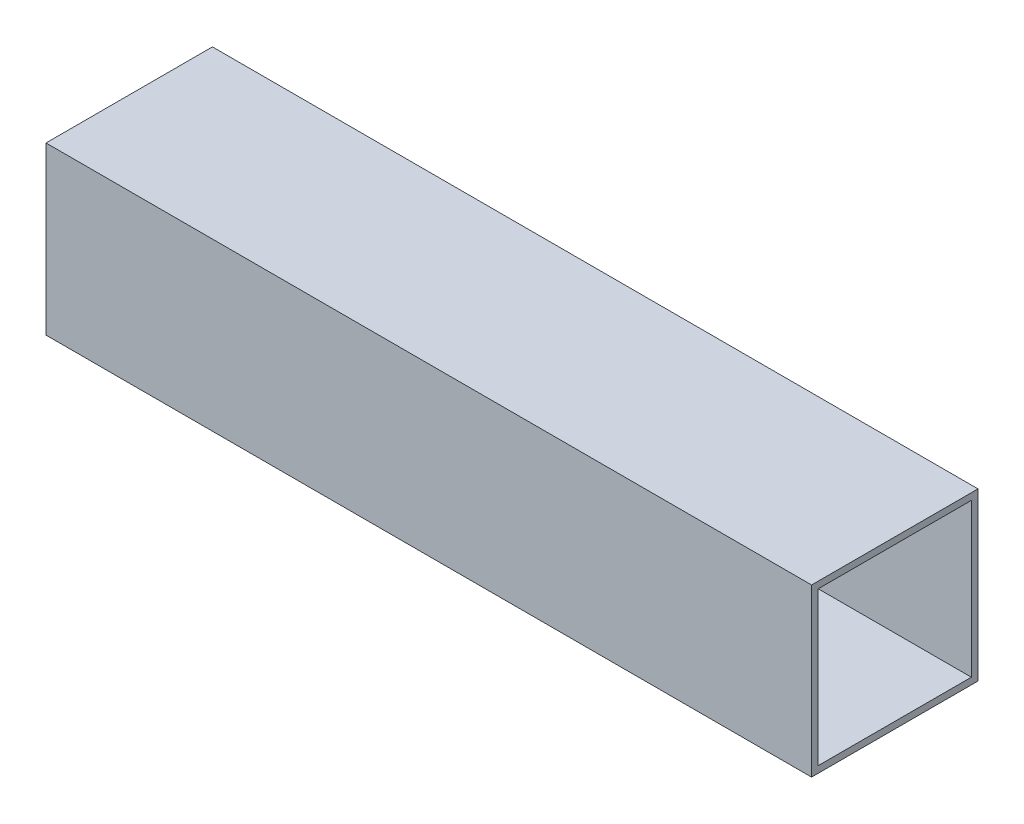
from build123d import *

# Parameters (mm, degrees)
SKETCH1_W           = 25
SKETCH1_H           = 25
SKETCH1_W_2         = 23
SKETCH1_H_2         = 23
BOSS_EXTRUDE1_DEPTH = 115


with BuildPart() as part:
    # Sketch1 → Boss-Extrude1 (new body)
    with BuildSketch(Plane(origin=(0, 0, 0), x_dir=(0, 0, -1), z_dir=(1, 0, 0))):
        Rectangle(SKETCH1_W, SKETCH1_H)
        Rectangle(SKETCH1_W_2, SKETCH1_H_2, mode=Mode.SUBTRACT)
    extrude(amount=BOSS_EXTRUDE1_DEPTH)


solid = part.part
